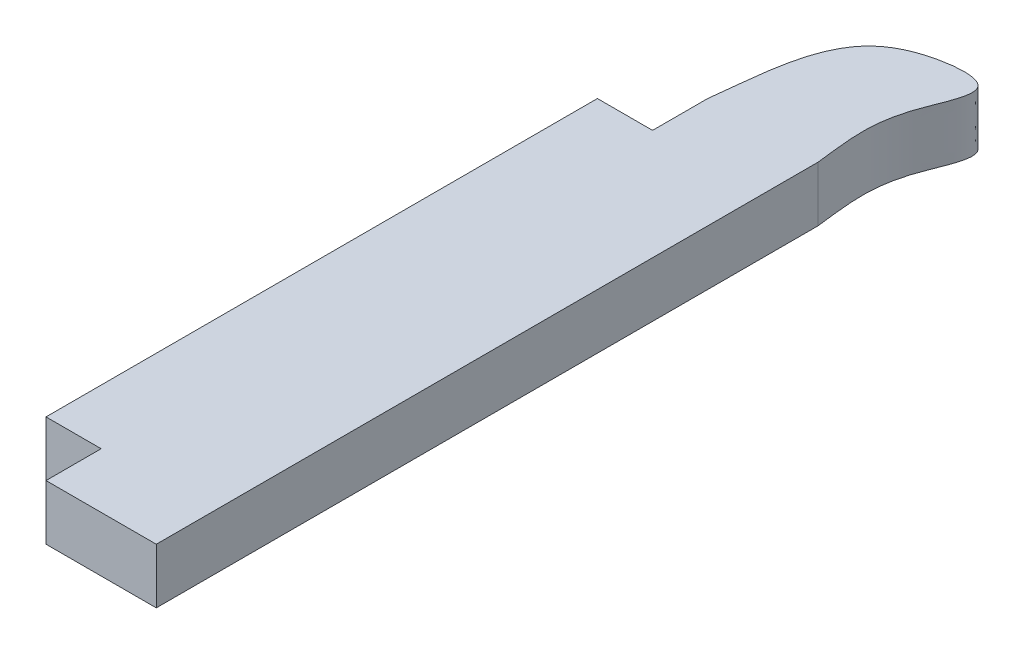
from build123d import *

# Parameters (mm, degrees)
SKETCH1_W           = 6.35
SKETCH1_H           = 3.175
BOSS_EXTRUDE1_DEPTH = 3.175
SKETCH2_W           = 3.175
SKETCH2_H           = 50.8
CUT_EXTRUDE1_DEPTH  = 29.671800602


with BuildPart() as part:
    # Sketch1 → Boss-Extrude1 (new body)
    with BuildSketch(Plane(origin=(0, 0, 0), x_dir=(1, 0, 0), z_dir=(0, 1, 0))):
        Polygon((3.175, -15.875), (6.35, -15.875), (6.35, 15.875), (3.175, 15.875), (-3.175, 15.875), (-6.35, 15.875), (-6.35, 0), (-6.35, -15.875), (-3.175, -15.875), align=None)
        with Locations((0, -17.4625)):
            Rectangle(SKETCH1_W, SKETCH1_H)
        with Locations((0, 17.4625)):
            Rectangle(SKETCH1_W, SKETCH1_H)
        with BuildLine():
            Line((-3.175, 19.05), (3.175, 19.05))
            add(Edge.make_bspline(
                [(-3.175, 19.05), (-2.890021494, 21.131483457), (-2.844958791, 25.590678805), (0.841652053, 27.703819165), (5.035463591, 28.046576523), (2.534345275, 23.283363782), (2.947430864, 21.061617738), (3.175, 19.05)],
                knots=[0, 0, 0, 0, 0.335744057, 0.477587418, 0.606964598, 0.742564211, 1, 1, 1, 1], degree=3))
        make_face()
    extrude(amount=BOSS_EXTRUDE1_DEPTH)

    # Sketch2 → Cut-Extrude1 (cut, through all)
    with BuildSketch(Plane(origin=(0, 3.175, 0), x_dir=(1, 0, 0), z_dir=(0, 1, 0))):
        with Locations((4.7625, -9.525)):
            Rectangle(SKETCH2_W, SKETCH2_H)
    extrude(amount=-CUT_EXTRUDE1_DEPTH, mode=Mode.SUBTRACT)


solid = part.part
